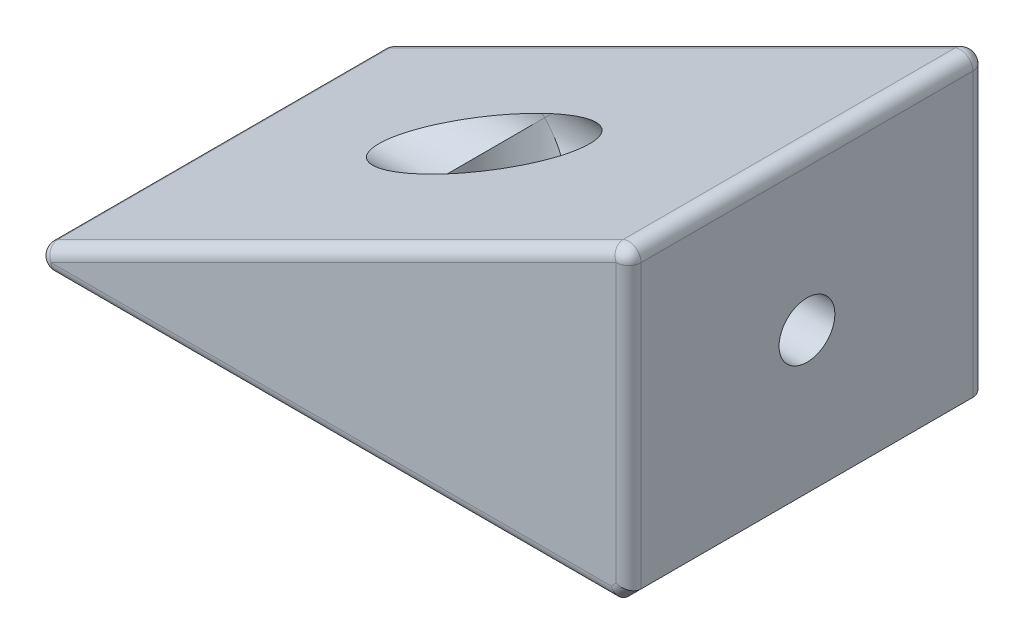
from build123d import *

# Parameters (mm, degrees)
BOSS_EXTRUDE2_DEPTH  = 14.375
M4_CLEARANCE_HOLE2_D = 4.5
CUT_EXTRUDE1_START   = -5
SKETCH10_R           = 4.25
CUT_EXTRUDE1_DEPTH   = 30
M4_CLEARANCE_HOLE3_D = 4.5
CUT_EXTRUDE2_START   = -5
SKETCH14_R           = 4.25
CUT_EXTRUDE2_DEPTH   = 30
CHAMFER1_SIZE        = 1
FILLET2_R            = 1


with BuildPart() as part:
    # Sketch5 → Boss-Extrude2 (new, symmetric)
    with BuildSketch(Plane.XY):
        Polygon((0, 0), (0, 25.4), (-50.8, 0), align=None)
    extrude(amount=BOSS_EXTRUDE2_DEPTH, both=True)

    # M4 Clearance Hole2 (through all)
    with Locations(Plane(origin=(0, 0, 0), x_dir=(0, 0, -1), z_dir=(1, 0, 0))):
        with Locations((0, 12.390983006)):
            Hole(M4_CLEARANCE_HOLE2_D / 2)

    # Sketch10 → Cut-Extrude1 (cut)
    with BuildSketch(Plane(origin=(0, 0, 0), x_dir=(0, 0, -1), z_dir=(1, 0, 0)).offset(CUT_EXTRUDE1_START)):
        with Locations((0, 12.390983006)):
            Circle(SKETCH10_R)
    extrude(amount=-CUT_EXTRUDE1_DEPTH, mode=Mode.SUBTRACT)

    # M4 Clearance Hole3 (through all)
    with Locations(Plane(origin=(0, 0, 0), x_dir=(-1, 0, 0), z_dir=(0, -1, 0))):
        with Locations((25.4, 0)):
            Hole(M4_CLEARANCE_HOLE3_D / 2)

    # Sketch14 → Cut-Extrude2 (cut)
    with BuildSketch(Plane.XZ.offset(CUT_EXTRUDE2_START)):
        with Locations(Location((-25.4, 0, 0), (0, 0, 270))):
            Circle(SKETCH14_R)
    extrude(amount=-CUT_EXTRUDE2_DEPTH, mode=Mode.SUBTRACT)

    # Chamfer1
    chamfer1_edges = [part.edges().sort_by_distance(p)[0] for p in [
        (0, 0, 0),
    ]]
    chamfer(chamfer1_edges, length=CHAMFER1_SIZE)

    # Fillet2
    fillet2_edges = [part.edges().sort_by_distance(p)[0] for p in [
        (-25.4, 12.7, 14.375),
        (-25.4, 12.7, -14.375),
        (-25.9, 0, -14.375),
        (-25.9, 0, 14.375),
        (0, 13.2, -14.375),
        (0, 13.2, 14.375),
        (-0.5, 0.5, -14.375),
        (-0.5, 0.5, 14.375),
        (-50.8, 0, 0),
        (0, 25.4, 0),
    ]]
    fillet(fillet2_edges, radius=FILLET2_R)


solid = part.part
